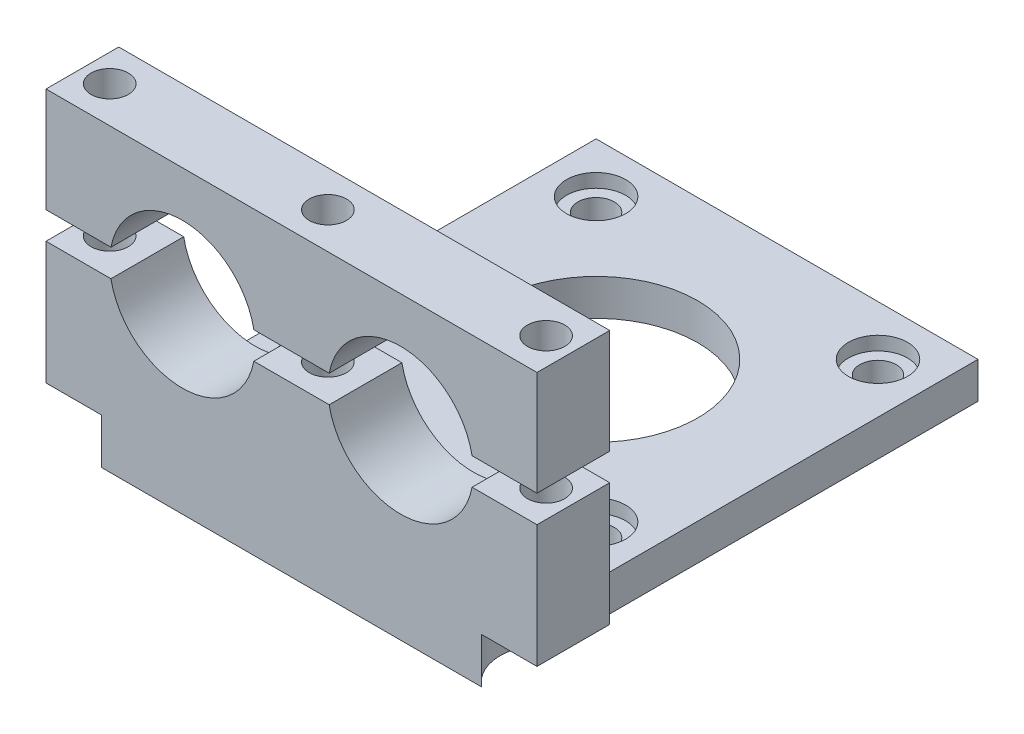
from build123d import *

# Parameters (mm, degrees)
SKETCH1_W           = 42
SKETCH1_H           = 54.5
SKETCH1_R           = 3.25
SKETCH1_R_2         = 11.175
BOSS_EXTRUDE1_DEPTH = 5
BOSS_EXTRUDE2_START = 5
SKETCH1_3_W         = 42
SKETCH1_3_H         = 8
BOSS_EXTRUDE2_DEPTH = 30
SKETCH2_R           = 8
CUT_EXTRUDE1_DEPTH  = 66.008808429
SKETCH3_R           = 2.05
CUT_EXTRUDE3_DEPTH  = 56.635668466
SKETCH1_4_W         = 6
SKETCH1_4_H         = 8
BOSS_EXTRUDE3_DEPTH = 18.5
SKETCH4_R           = 2.05
CUT_EXTRUDE4_DEPTH  = 51.952348832
SKETCH5_W           = 7.141883177
SKETCH5_H           = 8
SKETCH5_R           = 2.05
BOSS_EXTRUDE4_DEPTH = 13.5
SKETCH6_W           = 54
SKETCH6_H           = 8
CUT_EXTRUDE5_DEPTH  = 5
SKETCH7_W           = 6
SKETCH7_H           = 8
CUT_EXTRUDE8_DEPTH  = 5
SKETCH8_R           = 5.05
SKETCH8_R_2         = 2.05
CUT_EXTRUDE9_DEPTH  = 5
CUT_EXTRUDE10_DEPTH = 1
SKETCH10_W          = 54
SKETCH10_H          = 8
SKETCH10_R          = 2.05
BOSS_EXTRUDE5_DEPTH = 3
SKETCH1_5_R         = 3.25
SKETCH1_5_R_2       = 2
BOSS_EXTRUDE6_DEPTH = 2.5


with BuildPart() as part:
    # Sketch1 → Boss-Extrude1 (new body)
    with BuildSketch(Plane(origin=(0, 0, 0), x_dir=(1, 0, 0), z_dir=(0, 1, 0))):
        with Locations((7.963687151, -4.865921788)):
            Rectangle(SKETCH1_W, SKETCH1_H)
        with Locations(Location((23.463687151, 16.884078212, 0), (0, 0, 270))):
            Circle(SKETCH1_R, mode=Mode.SUBTRACT)
        with Locations(Location((-7.536312849, -14.115921788, 0), (0, 0, 270))):
            Circle(SKETCH1_R, mode=Mode.SUBTRACT)
        with Locations(Location((23.463687151, -14.115921788, 0), (0, 0, 270))):
            Circle(SKETCH1_R, mode=Mode.SUBTRACT)
        with Locations(Location((7.963687151, 1.384078212, 0), (0, 0, 270))):
            Circle(SKETCH1_R_2, mode=Mode.SUBTRACT)
        with Locations(Location((-7.536312849, 16.884078212, 0), (0, 0, 270))):
            Circle(SKETCH1_R, mode=Mode.SUBTRACT)
    extrude(amount=BOSS_EXTRUDE1_DEPTH)

    # Sketch1<3> → Boss-Extrude2 (add)
    with BuildSketch(Plane(origin=(0, 0, 0), x_dir=(1, 0, 0), z_dir=(0, 1, 0)).offset(BOSS_EXTRUDE2_START)):
        with Locations((7.963687151, -28.115921788)):
            Rectangle(SKETCH1_3_W, SKETCH1_3_H)
    extrude(amount=BOSS_EXTRUDE2_DEPTH)

    # Sketch2 → Cut-Extrude1 (cut, through all)
    with BuildSketch(Plane(origin=(0, 0, 24.115921788), x_dir=(-1, 0, 0), z_dir=(0, 0, -1))):
        with Locations((4.036312849, 20)):
            Circle(SKETCH2_R)
        with Locations((-19.963687151, 20)):
            Circle(SKETCH2_R)
        Polygon((-28.963687151, 20), (-28.963687151, 21.5), (13.036312849, 21.5), (13.036312849, 20), (13.036312849, 18.5), (-28.963687151, 18.5), align=None)
    extrude(amount=-CUT_EXTRUDE1_DEPTH, mode=Mode.SUBTRACT)


with BuildPart() as cut_extrude1_piece_1:
    # of the separate pieces the step leaves, piece 1, a body of its own (cut_extrude1_pieces)
    add(part.part.solids().sort_by_distance((-13.036312849, 18.5, 32.115921788))[0])


with BuildPart() as cut_extrude1_piece_2:
    # of the separate pieces the step leaves, piece 2, a body of its own (cut_extrude1_pieces)
    add(part.part.solids().sort_by_distance((-13.036312849, 35, 32.115921788))[0])


with BuildPart() as cut_extrude3_tool:
    # Sketch3 → Cut-Extrude3 (new, through all)
    with BuildSketch(Plane(origin=(0, 35, 0), x_dir=(1, 0, 0), z_dir=(0, 1, 0))):
        with Locations(Location((7.963687151, -28.115921788, 0), (0, 0, 270))):
            Circle(SKETCH3_R)
    extrude(amount=-CUT_EXTRUDE3_DEPTH)


with BuildPart() as cut_extrude1_piece_1_1:
    add(cut_extrude1_piece_1.part)

    # Cut-Extrude3: cut by cut_extrude3_tool
    add(cut_extrude3_tool.part, mode=Mode.SUBTRACT)

    # Sketch1<4> → Boss-Extrude3 (add)
    with BuildSketch(Plane(origin=(0, 0, 0), x_dir=(1, 0, 0), z_dir=(0, 1, 0))):
        with Locations((31.963687151, -28.115921788)):
            Rectangle(SKETCH1_4_W, SKETCH1_4_H)
        with Locations((-16.036312849, -28.115921788)):
            Rectangle(SKETCH1_4_W, SKETCH1_4_H)
    extrude(amount=BOSS_EXTRUDE3_DEPTH)

    # Sketch4 → Cut-Extrude4 (cut, through all)
    with BuildSketch(Plane(origin=(0, 18.5, 0), x_dir=(1, 0, 0), z_dir=(0, 1, 0))):
        with Locations(Location((-16.036312849, -28.115921788, 0), (0, 0, 180))):
            Circle(SKETCH4_R)
        with Locations(Location((31.963687151, -28.115921788, 0), (0, 0, 180))):
            Circle(SKETCH4_R)
    extrude(amount=-CUT_EXTRUDE4_DEPTH, mode=Mode.SUBTRACT)

    # Sketch7 → Cut-Extrude8 (cut)
    with BuildSketch(Plane.XZ):
        with Locations((-16.036312849, 28.115921788)):
            Rectangle(SKETCH7_W, SKETCH7_H)
        with Locations((31.963687151, 28.115921788)):
            Rectangle(SKETCH7_W, SKETCH7_H)
    extrude(amount=-CUT_EXTRUDE8_DEPTH, mode=Mode.SUBTRACT)

    # Sketch8 → Cut-Extrude9 (cut)
    # profile 1 of 2: a face of its own
    with BuildSketch(Plane.XZ):
        with Locations((-16.036312849, 28.115921788)):
            Circle(SKETCH8_R)
        with Locations(Location((-16.036312849, 28.115921788, 0), (0, 0, 180))):
            Circle(SKETCH8_R_2, mode=Mode.SUBTRACT)
    # profile 2 of 2: a face of its own
    with BuildSketch(Plane.XZ):
        with Locations((31.963687151, 28.115921788)):
            Circle(SKETCH8_R)
        with Locations(Location((31.963687151, 28.115921788, 0), (0, 0, 180))):
            Circle(SKETCH8_R_2, mode=Mode.SUBTRACT)
    extrude(amount=-CUT_EXTRUDE9_DEPTH, mode=Mode.SUBTRACT)

    # Sketch9 → Cut-Extrude10 (cut)
    with BuildSketch(Plane(origin=(0, 5, 0), x_dir=(1, 0, 0), z_dir=(0, 1, 0))):
        with BuildLine():
            Line((-12.953700321, -24.115921788), (28.881074622, -24.115921788))
            ThreePointArc((28.881074622, -24.115921788), (28.922221229, -24.084546706), (28.963687151, -24.053594868))
            Line((28.963687151, -24.053594868), (28.963687151, 22.384078212))
            Line((28.963687151, 22.384078212), (-13.036312849, 22.384078212))
            Line((-13.036312849, 22.384078212), (-13.036312849, -24.053594868))
            ThreePointArc((-13.036312849, -24.053594868), (-12.994846927, -24.084546706), (-12.953700321, -24.115921788))
        make_face()
    extrude(amount=-CUT_EXTRUDE10_DEPTH, mode=Mode.SUBTRACT)

    # Sketch1<5> → Boss-Extrude6 (add)
    # profile 1 of 4: a face of its own
    with BuildSketch(Plane(origin=(0, 0, 0), x_dir=(1, 0, 0), z_dir=(0, 1, 0))):
        with Locations(Location((23.463687151, 16.884078212, 0), (0, 0, 270))):
            Circle(SKETCH1_5_R)
        with Locations(Location((23.463687151, 16.884078212, 0), (0, 0, 270))):
            Circle(SKETCH1_5_R_2, mode=Mode.SUBTRACT)
    # profile 2 of 4: a face of its own
    with BuildSketch(Plane(origin=(0, 0, 0), x_dir=(1, 0, 0), z_dir=(0, 1, 0))):
        with Locations(Location((23.463687151, -14.115921788, 0), (0, 0, 270))):
            Circle(SKETCH1_5_R)
        with Locations(Location((23.463687151, -14.115921788, 0), (0, 0, 270))):
            Circle(SKETCH1_5_R_2, mode=Mode.SUBTRACT)
    # profile 3 of 4: a face of its own
    with BuildSketch(Plane(origin=(0, 0, 0), x_dir=(1, 0, 0), z_dir=(0, 1, 0))):
        with Locations(Location((-7.536312849, 16.884078212, 0), (0, 0, 270))):
            Circle(SKETCH1_5_R)
        with Locations(Location((-7.536312849, 16.884078212, 0), (0, 0, 270))):
            Circle(SKETCH1_5_R_2, mode=Mode.SUBTRACT)
    # profile 4 of 4: a face of its own
    with BuildSketch(Plane(origin=(0, 0, 0), x_dir=(1, 0, 0), z_dir=(0, 1, 0))):
        with Locations(Location((-7.536312849, -14.115921788, 0), (0, 0, 270))):
            Circle(SKETCH1_5_R)
        with Locations(Location((-7.536312849, -14.115921788, 0), (0, 0, 270))):
            Circle(SKETCH1_5_R_2, mode=Mode.SUBTRACT)
    extrude(amount=BOSS_EXTRUDE6_DEPTH)


with BuildPart() as cut_extrude1_piece_2_1:
    add(cut_extrude1_piece_2.part)

    # Cut-Extrude3: cut by cut_extrude3_tool
    add(cut_extrude3_tool.part, mode=Mode.SUBTRACT)

    # Sketch5 → Boss-Extrude4 (add)
    # profile 1 of 2: a face of its own
    with BuildSketch(Plane(origin=(0, 35, 0), x_dir=(1, 0, 0), z_dir=(0, 1, 0))):
        with Locations((-15.465371261, -28.115921788)):
            Rectangle(SKETCH5_W, SKETCH5_H)
        with Locations(Location((-16.036312849, -28.115921788, 0), (0, 0, 180))):
            Circle(SKETCH5_R, mode=Mode.SUBTRACT)
    # profile 2 of 2: a face of its own
    with BuildSketch(Plane(origin=(0, 35, 0), x_dir=(1, 0, 0), z_dir=(0, 1, 0))):
        with Locations((31.392745563, -28.115921788)):
            Rectangle(SKETCH5_W, SKETCH5_H)
        with Locations(Location((31.963687151, -28.115921788, 0), (0, 0, 180))):
            Circle(SKETCH5_R, mode=Mode.SUBTRACT)
    extrude(amount=-BOSS_EXTRUDE4_DEPTH)

    # Sketch6 → Cut-Extrude5 (cut)
    with BuildSketch(Plane(origin=(0, 35, 0), x_dir=(1, 0, 0), z_dir=(0, 1, 0))):
        with Locations((7.963687151, -28.115921788)):
            Rectangle(SKETCH6_W, SKETCH6_H)
    extrude(amount=-CUT_EXTRUDE5_DEPTH, mode=Mode.SUBTRACT)

    # Sketch10 → Boss-Extrude5 (add)
    with BuildSketch(Plane(origin=(0, 30, 0), x_dir=(1, 0, 0), z_dir=(0, 1, 0))):
        with Locations((7.963687151, -28.115921788)):
            Rectangle(SKETCH10_W, SKETCH10_H)
        with Locations(Location((31.963687151, -28.115921788, 0), (0, 0, 180))):
            Circle(SKETCH10_R, mode=Mode.SUBTRACT)
        with Locations(Location((7.963687151, -28.115921788, 0), (0, 0, 270))):
            Circle(SKETCH10_R, mode=Mode.SUBTRACT)
        with Locations(Location((-16.036312849, -28.115921788, 0), (0, 0, 180))):
            Circle(SKETCH10_R, mode=Mode.SUBTRACT)
    extrude(amount=BOSS_EXTRUDE5_DEPTH)


solid = Compound([cut_extrude1_piece_1_1.part, cut_extrude1_piece_2_1.part])
